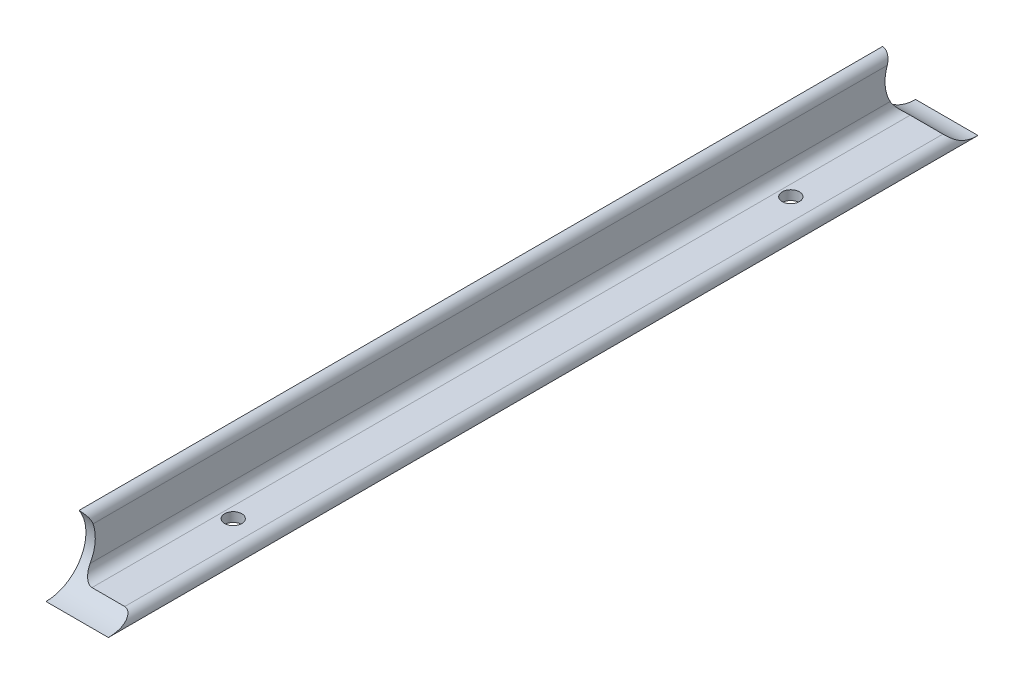
from build123d import *

# Parameters (mm, degrees)
MIEMBRO_ESTRUCTURAL1_DEPTH   = 278.7
CORTAR_EXTRUIR2_DEPTH        = 184.563144285
TALADRO_DE_MARGEN_PARA_M51_D = 5.5


with BuildPart() as part:
    # Sketch1 → Miembro estructural1 (new body)
    with BuildSketch(Plane.XY.offset(-97.329032258)):
        with BuildLine():
            Line((0, 0), (0, 20))
            ThreePointArc((0, 20), (2.121320344, 19.121320344), (3, 17))
            Line((3, 17), (3, 6.5))
            ThreePointArc((3, 6.5), (4.025126266, 4.025126266), (6.5, 3))
            Line((6.5, 3), (17, 3))
            ThreePointArc((17, 3), (19.121320344, 2.121320344), (20, 0))
            Line((20, 0), (0, 0))
        make_face()
    extrude(amount=MIEMBRO_ESTRUCTURAL1_DEPTH)

    # Croquis2 → Cortar-Extruir2 (cut, through all)
    with BuildSketch(Plane.YZ):
        with BuildLine():
            Line((0, -97.329032258), (0, -196.975216041))
            Line((0, -196.975216041), (22.851984592, -196.975216041))
            Line((22.851984592, -196.975216041), (22.851984592, -180.447153459))
            Line((22.851984592, -180.447153459), (12.695152183, -110.128602834))
            ThreePointArc((12.695152183, -110.128602834), (21.887960499, -88.315210983), (0, -97.329032258))
        make_face()
        with BuildLine():
            Line((22.851984592, 264.489088943), (12.695152183, 194.170538318))
            ThreePointArc((12.695152183, 194.170538318), (21.887960499, 172.357146467), (0, 181.370967742))
            Line((0, 181.370967742), (0, 281.017151525))
            Line((0, 281.017151525), (22.851984592, 281.017151525))
            Line((22.851984592, 281.017151525), (22.851984592, 264.489088943))
        make_face()
    extrude(amount=CORTAR_EXTRUIR2_DEPTH, mode=Mode.SUBTRACT)

    # Taladro de margen para M51 (through all)
    with Locations(Plane(origin=(0, 0, 0), x_dir=(-1, 0, 0), z_dir=(0, -1, 0))):
        with Locations((-10, -131.370967742), (-10, 47.329032258)):
            Hole(TALADRO_DE_MARGEN_PARA_M51_D / 2)


solid = part.part
